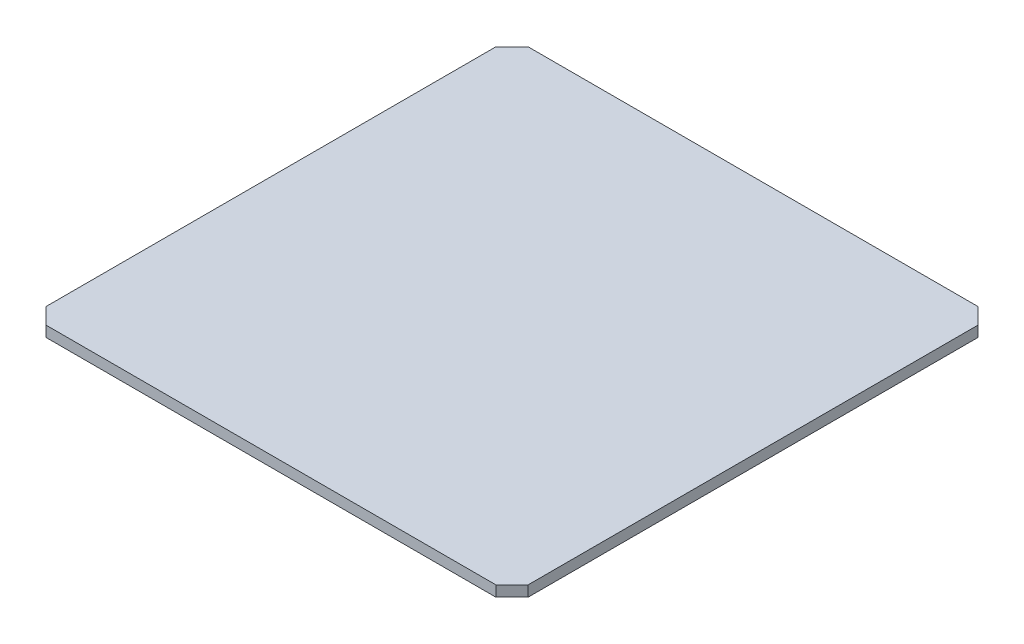
from build123d import *

# Parameters (mm, degrees)
BOSS_EXTRU_1_DEPTH = 2
ESQUISSE2_R        = 4
ESQUISSE2_R_2      = 1.5
BOSS_EXTRU_2_DEPTH = 6.25
ESQUISSE3_W        = 15
ESQUISSE3_H        = 7.5
BOSS_EXTRU_3_DEPTH = 10


with BuildPart() as part:
    # Esquisse1 → Boss.-Extru.1 (new body)
    with BuildSketch(Plane(origin=(0, 0, 0), x_dir=(1, 0, 0), z_dir=(0, 1, 0))):
        Polygon((-42, 45), (42, 45), (45, 42), (45, -42), (42, -45), (-42, -45), (-45, -42), (-45, 42), align=None)
    extrude(amount=BOSS_EXTRU_1_DEPTH)

    # Esquisse2 → Boss.-Extru.2 (add)
    # profile 1 of 4: a face of its own
    with BuildSketch(Plane.XZ):
        with Locations(Location((-24.5, 24.5, 0), (0, 0, 270))):
            Circle(ESQUISSE2_R)
        with Locations(Location((-24.5, 24.5, 0), (0, 0, 270))):
            Circle(ESQUISSE2_R_2, mode=Mode.SUBTRACT)
    # profile 2 of 4: a face of its own
    with BuildSketch(Plane.XZ):
        with Locations(Location((24.5, 24.5, 0), (0, 0, 270))):
            Circle(ESQUISSE2_R)
        with Locations(Location((24.5, 24.5, 0), (0, 0, 270))):
            Circle(ESQUISSE2_R_2, mode=Mode.SUBTRACT)
    # profile 3 of 4: a face of its own
    with BuildSketch(Plane.XZ):
        with Locations(Location((-24.5, -24.5, 0), (0, 0, 270))):
            Circle(ESQUISSE2_R)
        with Locations(Location((-24.5, -24.5, 0), (0, 0, 270))):
            Circle(ESQUISSE2_R_2, mode=Mode.SUBTRACT)
    # profile 4 of 4: a face of its own
    with BuildSketch(Plane.XZ):
        with Locations(Location((24.5, -24.5, 0), (0, 0, 270))):
            Circle(ESQUISSE2_R)
        with Locations(Location((24.5, -24.5, 0), (0, 0, 270))):
            Circle(ESQUISSE2_R_2, mode=Mode.SUBTRACT)
    extrude(amount=BOSS_EXTRU_2_DEPTH)

    # Esquisse3 → Boss.-Extru.3 (add)
    with BuildSketch(Plane.XZ):
        Rectangle(ESQUISSE3_W, ESQUISSE3_H)
    extrude(amount=BOSS_EXTRU_3_DEPTH)


solid = part.part
